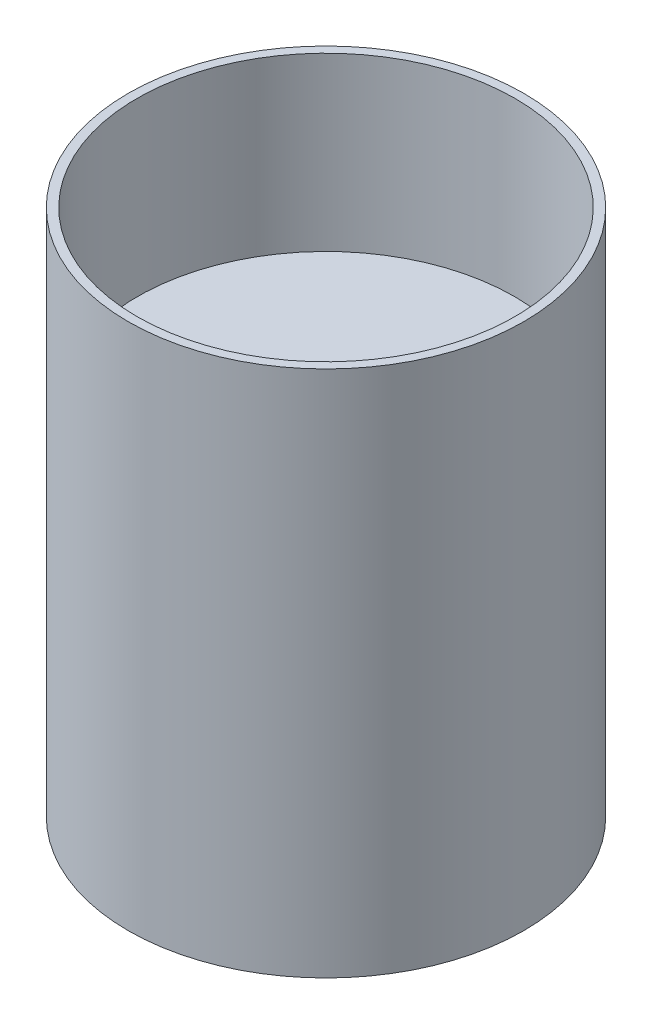
from build123d import *

# Parameters (mm, degrees)
SKETCH1_R          = 45
JAR_BODY_DEPTH     = 120
JAR_CAVITY_START   = 3
SKETCH2_R          = 43
JAR_CAVITY_DEPTH   = 120
WATER_VISUAL_START = 3
SKETCH3_R          = 42.9
WATER_VISUAL_DEPTH = 78


with BuildPart() as part:
    # Sketch1 → Jar_Body (new body)
    with BuildSketch(Plane(origin=(0, 0, 0), x_dir=(1, 0, 0), z_dir=(0, 1, 0))):
        with Locations(Location((0, 0, 0), (0, 0, 270))):
            Circle(SKETCH1_R)
    extrude(amount=JAR_BODY_DEPTH)

    # Sketch2 → Jar_Cavity (cut)
    with BuildSketch(Plane(origin=(0, 0, 0), x_dir=(1, 0, 0), z_dir=(0, 1, 0)).offset(JAR_CAVITY_START)):
        with Locations(Location((0, 0, 0), (0, 0, 270))):
            Circle(SKETCH2_R)
    extrude(amount=JAR_CAVITY_DEPTH, mode=Mode.SUBTRACT)


with BuildPart() as body_2:
    # Sketch3 → Water_Visual (new body)
    with BuildSketch(Plane(origin=(0, 0, 0), x_dir=(1, 0, 0), z_dir=(0, 1, 0)).offset(WATER_VISUAL_START)):
        with Locations(Location((0, 0, 0), (0, 0, 270))):
            Circle(SKETCH3_R)
    extrude(amount=WATER_VISUAL_DEPTH)


solid = Compound([part.part, body_2.part])
